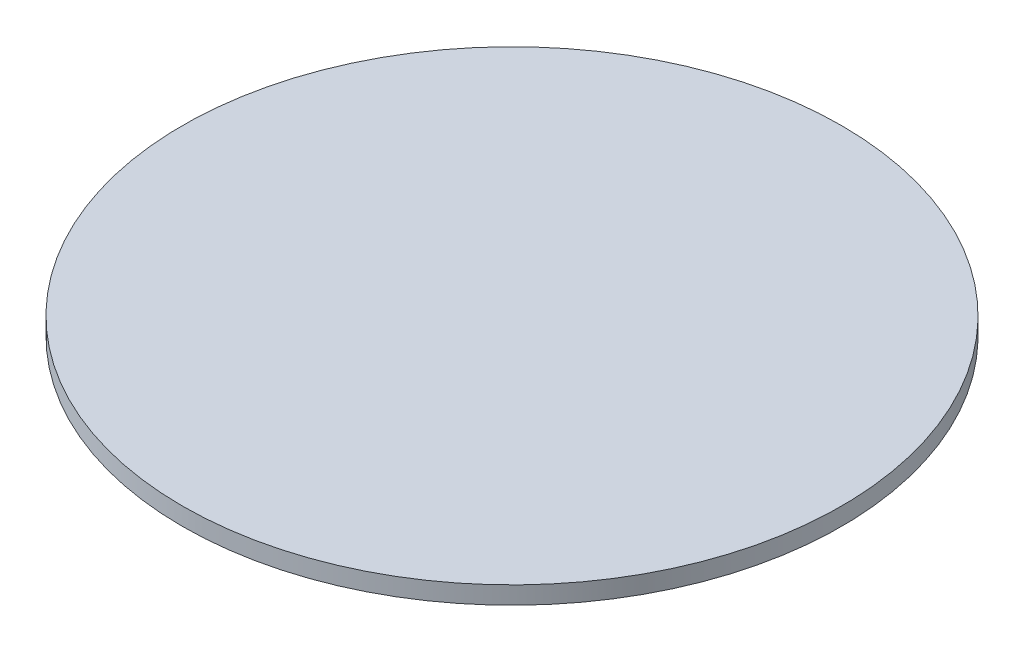
from build123d import *

# Parameters (mm, degrees)
SKETCH1_R           = 28
BOSS_EXTRUDE1_DEPTH = 1.5
SCALE1_SCALE        = 0.64


with BuildPart() as part:
    # Sketch1 → Boss-Extrude1 (new body)
    with BuildSketch(Plane(origin=(0, 0, 0), x_dir=(1, 0, 0), z_dir=(0, 1, 0))):
        with Locations(Location((0, 0, 0), (0, 0, 270))):
            Circle(SKETCH1_R)
    extrude(amount=BOSS_EXTRUDE1_DEPTH)


with BuildPart() as part_1:
    # Scale1: scaled about (0, 0.75, 0)
    add(part.part.scale(SCALE1_SCALE).moved(Location((0, 0.27, 0))))


solid = part_1.part
